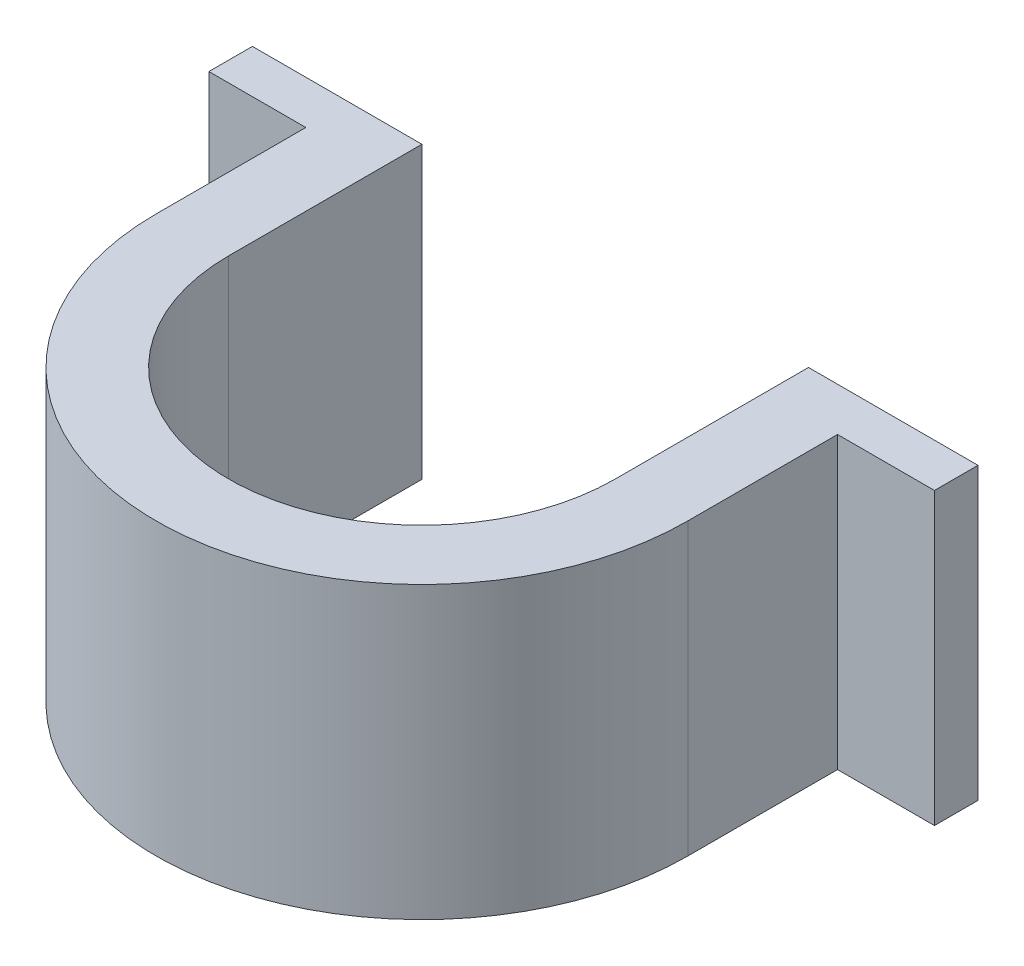
from build123d import *

# Parameters (mm, degrees)
BOSS_EXTRUDE1_DEPTH = 20


with BuildPart() as part:
    # Sketch1 → Boss-Extrude1 (new body)
    with BuildSketch(Plane(origin=(0, 0, 0), x_dir=(1, 0, 0), z_dir=(0, 1, 0))):
        with BuildLine():
            Line((-18.32, 0), (-18.32, 2.075569274))
            Line((-18.32, 2.075569274), (-18.32, 10.32))
            Line((-18.32, 10.32), (-25, 10.32))
            Line((-25, 10.32), (-25, 13.32))
            Line((-25, 13.32), (-13.32, 13.32))
            Line((-13.32, 13.32), (-13.32, 0))
            ThreePointArc((-13.32, 0), (0, -13.32), (13.32, 0))
            Line((13.32, 0), (13.32, 13.32))
            Line((13.32, 13.32), (25, 13.32))
            Line((25, 13.32), (25, 10.32))
            Line((25, 10.32), (18.32, 10.32))
            Line((18.32, 10.32), (18.32, 1.685292353))
            Line((18.32, 1.685292353), (18.32, 0))
            ThreePointArc((18.32, 0), (0, -18.32), (-18.32, 0))
        make_face()
    extrude(amount=BOSS_EXTRUDE1_DEPTH)


solid = part.part
